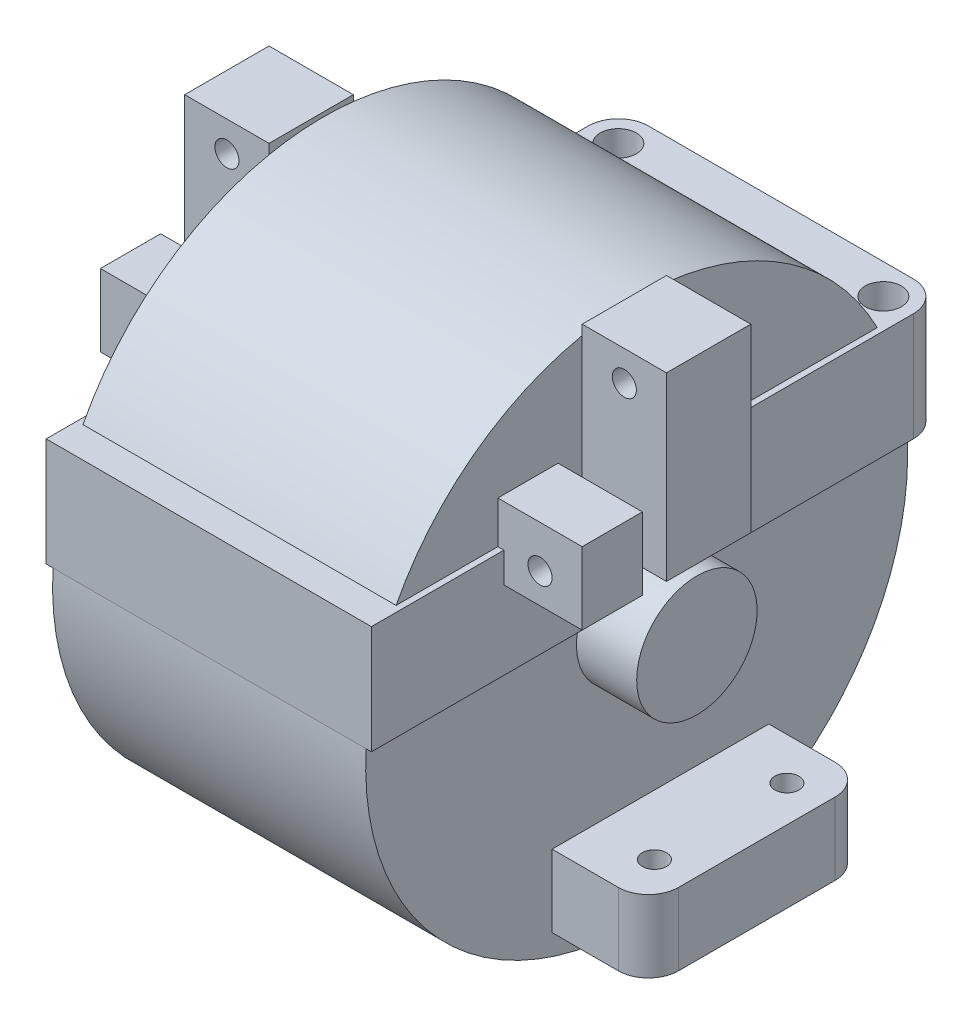
from build123d import *
from build123d.topology import SkipClean

# Parameters (mm, degrees)
SKETCH3_W                 = 27
SKETCH3_H                 = 47.5
SKETCH3_R                 = 1.5
BOSS_EXTRUDE1_DEPTH       = 9
FILLET1_R                 = 2.5
SKETCH4_W                 = 26
SKETCH4_H                 = 44
BOSS_EXTRUDE5_DEPTH       = 15
SKETCH5_W                 = 25
SKETCH5_H                 = 18
BOSS_EXTRUDE6_DEPTH       = 5
SKETCH5_3_W               = 42
SKETCH5_3_H               = 18
SKETCH5_3_R               = 1
BOSS_EXTRUDE7_DEPTH       = 6
FILLET4_R                 = 2.5
CUT_EXTRUDE1_DEPTH        = 47.487229429
SKETCH6_5_R               = 22.5
BOSS_EXTRUDE8_DEPTH       = 26
SKETCH9_W                 = 7
SKETCH9_H                 = 15
SKETCH9_W_2               = 5
SKETCH9_H_2               = 6
BOSS_EXTRUDE9_DEPTH       = 7
SKETCH10_R                = 1
CUT_EXTRUDE2_DEPTH        = 41.437511922
BOSS_EXTRUDE10_DEPTH      = 5
BOSS_EXTRUDE10_DEPTH_BACK = 31
SKETCH6_6_R               = 5


with BuildPart() as part:
    # Sketch3 → Boss-Extrude1 (new body)
    with BuildSketch(Plane(origin=(0, 0, 0), x_dir=(1, 0, 0), z_dir=(0, 1, 0))):
        Rectangle(SKETCH3_W, SKETCH3_H)
        with Locations(Location((-11, 21.25, 0), (0, 0, 270))):
            Circle(SKETCH3_R, mode=Mode.SUBTRACT)
        with Locations(Location((11, 21.25, 0), (0, 0, 90))):
            Circle(SKETCH3_R, mode=Mode.SUBTRACT)
    extrude(amount=BOSS_EXTRUDE1_DEPTH)

    # Fillet1
    fillet1_edges = [part.edges().sort_by_distance(p)[0] for p in [
        (-13.5, 4.5, -23.75),
        (13.5, 4.5, -23.75),
    ]]
    fillet(fillet1_edges, radius=FILLET1_R)

    # Sketch4 → Boss-Extrude5 (add)
    with BuildSketch(Plane.XZ):
        Rectangle(SKETCH4_W, SKETCH4_H)
    extrude(amount=BOSS_EXTRUDE5_DEPTH)

    # Sketch5 → Boss-Extrude6 (add)
    with BuildSketch(Plane.XZ.offset(15)):
        with Locations((0, -0.75)):
            Rectangle(SKETCH5_W, SKETCH5_H)
    extrude(amount=-BOSS_EXTRUDE6_DEPTH)

    # Sketch5<3> → Boss-Extrude7 (add)
    with BuildSketch(Plane.XZ.offset(15)):
        with Locations((0, -0.75)):
            Rectangle(SKETCH5_3_W, SKETCH5_3_H)
        with Locations(Location((-18, -6.25, 0), (0, 0, 270))):
            Circle(SKETCH5_3_R, mode=Mode.SUBTRACT)
        with Locations(Location((18, -6.25, 0), (0, 0, 270))):
            Circle(SKETCH5_3_R, mode=Mode.SUBTRACT)
        with Locations(Location((-18, 4.75, 0), (0, 0, 270))):
            Circle(SKETCH5_3_R, mode=Mode.SUBTRACT)
        with Locations(Location((18, 4.75, 0), (0, 0, 270))):
            Circle(SKETCH5_3_R, mode=Mode.SUBTRACT)
    extrude(amount=BOSS_EXTRUDE7_DEPTH)

    # Fillet4
    fillet4_edges = [part.edges().sort_by_distance(p)[0] for p in [
        (21, -18, 8.25),
        (-21, -18, 8.25),
        (-21, -18, -9.75),
        (21, -18, -9.75),
    ]]
    fillet(fillet4_edges, radius=FILLET4_R)

    # Sketch6 → Cut-Extrude1 (cut, through all)
    with BuildSketch(Plane.ZY.offset(13)):
        with BuildLine():
            ThreePointArc((-16.66827394, -15), (-20.300466386, -7.910658998), (-21.234838924, 0))
            Line((-21.234838924, 0), (-22, 0))
            Line((-22, 0), (-22, -15))
            Line((-22, -15), (-16.66827394, -15))
        make_face()
        with BuildLine():
            Line((22, -15), (22, -9.995713029))
            ThreePointArc((22, -9.995713029), (20.719530361, -12.590758918), (19.116588355, -15))
            Line((19.116588355, -15), (22, -15))
        make_face()
    extrude(amount=-CUT_EXTRUDE1_DEPTH, mode=Mode.SUBTRACT)

    # Sketch6<5> → Boss-Extrude8 (add)
    with BuildSketch(Plane.ZY.offset(13)):
        with Locations((1.224157208, -1.357752838)):
            Circle(SKETCH6_5_R)
    extrude(amount=-BOSS_EXTRUDE8_DEPTH)

    # Sketch9 → Boss-Extrude9 (add)
    with BuildSketch(Plane.ZY.offset(13)):
        with Locations((2.25, 14)):
            Rectangle(SKETCH9_W, SKETCH9_H)
        with Locations((10.25, 9.5)):
            Rectangle(SKETCH9_W_2, SKETCH9_H_2)
    boss_extrude9 = extrude(amount=BOSS_EXTRUDE9_DEPTH)

    # Sketch10 → Cut-Extrude2 (cut, through all)
    with BuildSketch(Plane(origin=(0, 0, -1.25), x_dir=(-1, 0, 0), z_dir=(0, 0, -1))):
        with Locations((16.5, 9)):
            Circle(SKETCH10_R)
        with Locations((16.5, 19)):
            Circle(SKETCH10_R)
    cut_extrude2 = extrude(amount=-CUT_EXTRUDE2_DEPTH, mode=Mode.SUBTRACT)

    # Mirror1: Boss-Extrude9, Cut-Extrude2 across plane
    add(boss_extrude9.mirror(Plane(origin=(0, 0, 0), x_dir=(0, 0, 1), z_dir=(1, 0, 0))))
    add(cut_extrude2.mirror(Plane(origin=(0, 0, 0), x_dir=(0, 0, 1), z_dir=(1, 0, 0))), mode=Mode.SUBTRACT)

    # Sketch6<6> → Boss-Extrude10 (add, two sides: drawn at the far end of the back side and taken through both)
    with SkipClean():  # the faces are left unmerged after this step: merging them gives an invalid solid
        with BuildSketch(Plane.ZY.offset(13).offset(-BOSS_EXTRUDE10_DEPTH_BACK)):
            with Locations((1.224157208, -1.357752838)):
                Circle(SKETCH6_6_R)
        extrude(amount=BOSS_EXTRUDE10_DEPTH + BOSS_EXTRUDE10_DEPTH_BACK)


solid = part.part
